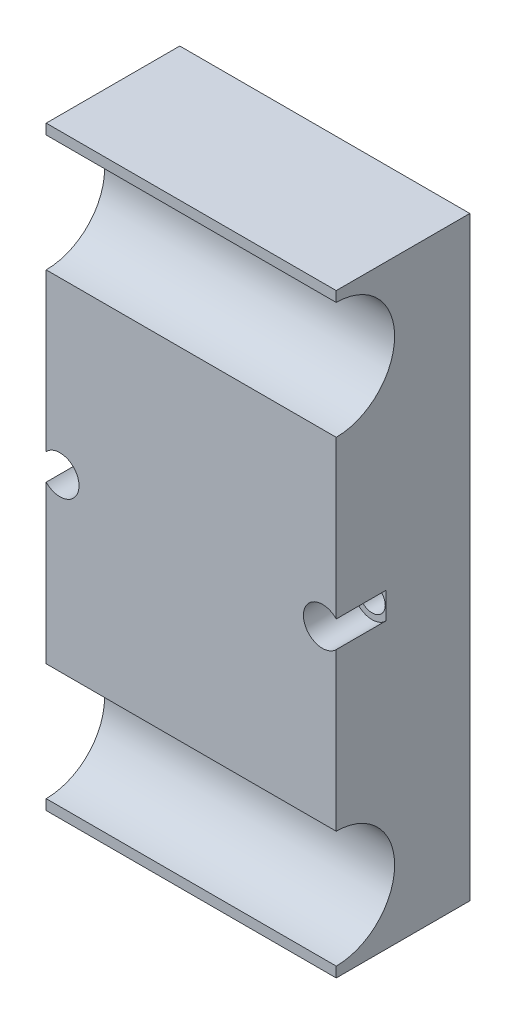
from build123d import *

# Parameters (mm, degrees)
SKETCH1_W           = 38
SKETCH1_H           = 78
BOSS_EXTRUDE1_DEPTH = 10
SKETCH2_W           = 30.5
SKETCH2_H           = 70.5
CUT_EXTRUDE1_DEPTH  = 8
BOSS_EXTRUDE2_DEPTH = 4
SKETCH4_W           = 38
SKETCH4_H           = 78
BOSS_EXTRUDE3_DEPTH = 7.5
SKETCH5_R           = 7.65
CUT_EXTRUDE2_DEPTH  = 89.511298714
SKETCH6_W           = 34.5
SKETCH6_H           = 74.5
SKETCH6_W_2         = 30.5
SKETCH6_H_2         = 70.5
CUT_EXTRUDE3_DEPTH  = 1
SKETCH7_R           = 1.725
CUT_EXTRUDE5_DEPTH  = 89.511298714
SKETCH8_R           = 2.5
CUT_EXTRUDE6_DEPTH  = 6.5


with BuildPart() as part:
    # Sketch1 → Boss-Extrude1 (new body)
    with BuildSketch(Plane.XY):
        with Locations((19, 39)):
            Rectangle(SKETCH1_W, SKETCH1_H)
    extrude(amount=BOSS_EXTRUDE1_DEPTH)

    # Sketch2 → Cut-Extrude1 (cut)
    with BuildSketch(Plane(origin=(0, 0, 0), x_dir=(-1, 0, 0), z_dir=(0, 0, -1))):
        with Locations((-19, 39)):
            Rectangle(SKETCH2_W, SKETCH2_H)
    extrude(amount=-CUT_EXTRUDE1_DEPTH, mode=Mode.SUBTRACT)

    # Sketch3 → Boss-Extrude2 (add)
    with BuildSketch(Plane(origin=(0, 0, 8), x_dir=(-1, 0, 0), z_dir=(0, 0, -1))):
        Polygon((-30.25, 74.25), (-34.25, 70.25), (-34.25, 74.25), align=None)
        Polygon((-3.75, 70.25), (-3.75, 74.25), (-7.75, 74.25), align=None)
        Polygon((-3.75, 7.75), (-3.75, 3.75), (-7.75, 3.75), align=None)
        Polygon((-34.25, 7.75), (-34.25, 3.75), (-30.25, 3.75), align=None)
    extrude(amount=BOSS_EXTRUDE2_DEPTH)

    # Sketch4 → Boss-Extrude3 (add)
    with BuildSketch(Plane.XY.offset(10)):
        with Locations((19, 39)):
            Rectangle(SKETCH4_W, SKETCH4_H)
    extrude(amount=BOSS_EXTRUDE3_DEPTH)

    # Sketch5 → Cut-Extrude2 (cut, through all)
    with BuildSketch(Plane(origin=(38, 0, 0), x_dir=(0, 0, -1), z_dir=(1, 0, 0))):
        with Locations((-17.5, 9)):
            Circle(SKETCH5_R)
        with Locations((-17.5, 69)):
            Circle(SKETCH5_R)
    extrude(amount=-CUT_EXTRUDE2_DEPTH, mode=Mode.SUBTRACT)

    # Sketch6 → Cut-Extrude3 (cut)
    with BuildSketch(Plane(origin=(0, 0, 0), x_dir=(-1, 0, 0), z_dir=(0, 0, -1))):
        with Locations((-19, 39)):
            Rectangle(SKETCH6_W, SKETCH6_H)
        with Locations((-19, 39)):
            Rectangle(SKETCH6_W_2, SKETCH6_H_2, mode=Mode.SUBTRACT)
    extrude(amount=-CUT_EXTRUDE3_DEPTH, mode=Mode.SUBTRACT)

    # Sketch7 → Cut-Extrude5 (cut, through all)
    with BuildSketch(Plane.XY.offset(17.5)):
        with Locations((1.8, 39)):
            Circle(SKETCH7_R)
        with Locations((36.2, 39)):
            Circle(SKETCH7_R)
    extrude(amount=-CUT_EXTRUDE5_DEPTH, mode=Mode.SUBTRACT)

    # Sketch8 → Cut-Extrude6 (cut)
    with BuildSketch(Plane.XY.offset(17.5)):
        with Locations((1.8, 39)):
            Circle(SKETCH8_R)
        with Locations((36.2, 39)):
            Circle(SKETCH8_R)
    extrude(amount=-CUT_EXTRUDE6_DEPTH, mode=Mode.SUBTRACT)


solid = part.part
